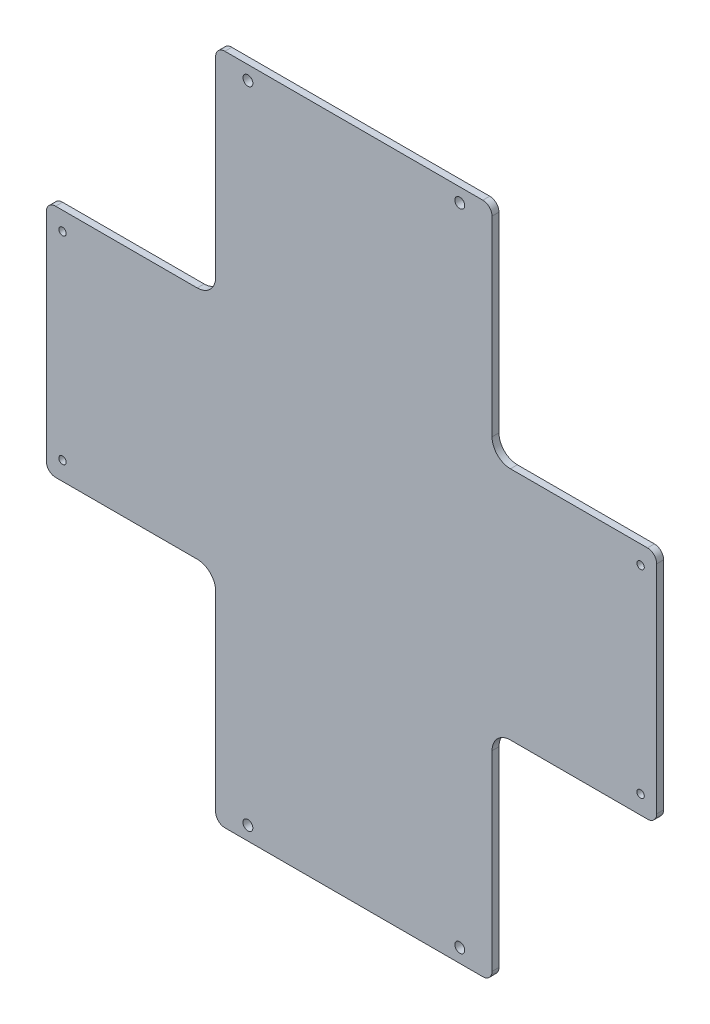
from build123d import *

# Parameters (mm, degrees)
SKETCH_183_R   = 2.15
SKETCH_183_R_2 = 1.6
F_3MM_DEPTH    = 3


with BuildPart() as part:
    # Sketch 183 → 二层板_拉伸3mm (new body)
    with BuildSketch(Plane.XY):
        with BuildLine():
            Line((-50, -146), (62, -146))
            ThreePointArc((62, -146), (64.828427125, -144.828427125), (66, -142))
            Line((66, -142), (66, -59))
            ThreePointArc((66, -59), (68.343145751, -53.343145751), (74, -51))
            Line((74, -51), (133.5, -51))
            ThreePointArc((133.5, -51), (136.328427125, -49.828427125), (137.5, -47))
            Line((137.5, -47), (137.5, 47))
            ThreePointArc((137.5, 47), (136.328427125, 49.828427125), (133.5, 51))
            Line((133.5, 51), (74, 51))
            ThreePointArc((74, 51), (68.343145751, 53.343145751), (66, 59))
            Line((66, 59), (66, 142))
            ThreePointArc((66, 142), (64.828427125, 144.828427125), (62, 146))
            Line((62, 146), (-50, 146))
            ThreePointArc((-50, 146), (-52.828427125, 144.828427125), (-54, 142))
            Line((-54, 142), (-54, 59))
            ThreePointArc((-54, 59), (-56.343145751, 53.343145751), (-62, 51))
            Line((-62, 51), (-123.5, 51))
            ThreePointArc((-123.5, 51), (-126.328427125, 49.828427125), (-127.5, 47))
            Line((-127.5, 47), (-127.5, -47))
            ThreePointArc((-127.5, -47), (-126.328427125, -49.828427125), (-123.5, -51))
            Line((-123.5, -51), (-62, -51))
            ThreePointArc((-62, -51), (-56.343145751, -53.343145751), (-54, -59))
            Line((-54, -59), (-54, -142))
            ThreePointArc((-54, -142), (-52.828427125, -144.828427125), (-50, -146))
        make_face()
        with Locations((-40, 140)):
            Circle(SKETCH_183_R, mode=Mode.SUBTRACT)
        with Locations((52, 140)):
            Circle(SKETCH_183_R, mode=Mode.SUBTRACT)
        with Locations((-120.5, 43)):
            Circle(SKETCH_183_R_2, mode=Mode.SUBTRACT)
        with Locations((130.5, 43)):
            Circle(SKETCH_183_R_2, mode=Mode.SUBTRACT)
        with Locations((-120.5, -43)):
            Circle(SKETCH_183_R_2, mode=Mode.SUBTRACT)
        with Locations((130.5, -43)):
            Circle(SKETCH_183_R_2, mode=Mode.SUBTRACT)
        with Locations((-40, -140)):
            Circle(SKETCH_183_R, mode=Mode.SUBTRACT)
        with Locations((52, -140)):
            Circle(SKETCH_183_R, mode=Mode.SUBTRACT)
    extrude(amount=F_3MM_DEPTH)


solid = part.part
